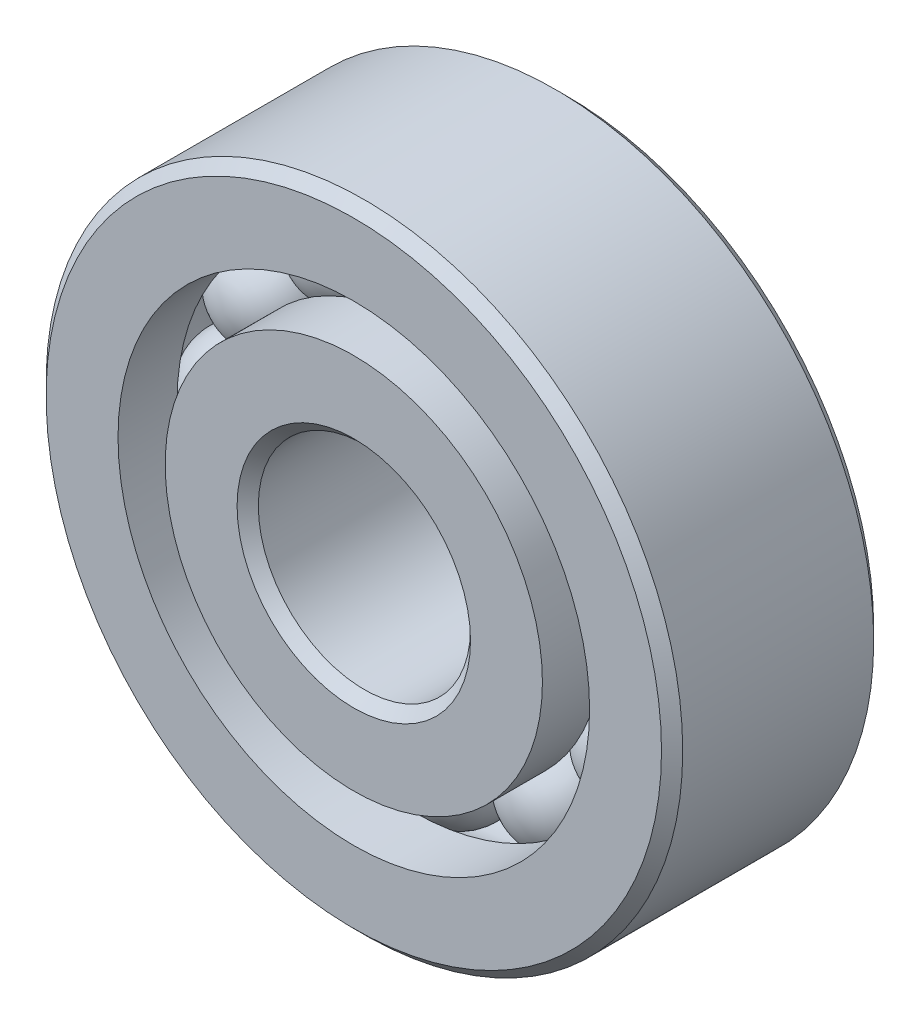
from build123d import *

# Parameters (mm, degrees)
CIRPATTERN1_COUNT = 12


with BuildPart() as part:
    # Sketch1 → Revolve1 (revolve)
    with BuildSketch(Plane(origin=(0, 0, 0), x_dir=(0, 0, -1), z_dir=(1, 0, 0))):
        with BuildLine():
            Line((0.45, 1.5), (-0.45, 1.5))
            Line((-0.45, 1.5), (-0.5, 1.45))
            Line((-0.5, 1.45), (-0.5, 1.111111111))
            Line((-0.5, 1.111111111), (-0.222222222, 1.111111111))
            ThreePointArc((-0.222222222, 1.111111111), (0, 1.248451997), (0.222222222, 1.111111111))
            Line((0.222222222, 1.111111111), (0.5, 1.111111111))
            Line((0.5, 1.111111111), (0.5, 1.45))
            Line((0.5, 1.45), (0.45, 1.5))
        make_face()
    revolve(axis=Axis((0, 0, 0.5), (0, 0, -1)))


with BuildPart() as body_2:
    # Sketch2 → Revolve2 (revolve)
    with BuildSketch(Plane(origin=(0, 0, 0), x_dir=(0, 0, -1), z_dir=(1, 0, 0))):
        with BuildLine():
            Line((-0.5, 0.888888889), (-0.222222222, 0.888888889))
            ThreePointArc((-0.222222222, 0.888888889), (0, 0.751548003), (0.222222222, 0.888888889))
            Line((0.222222222, 0.888888889), (0.5, 0.888888889))
            Line((0.5, 0.888888889), (0.5, 0.55))
            Line((0.5, 0.55), (0.45, 0.5))
            Line((0.45, 0.5), (-0.45, 0.5))
            Line((-0.45, 0.5), (-0.5, 0.55))
            Line((-0.5, 0.55), (-0.5, 0.888888889))
        make_face()
    revolve(axis=Axis((0, 0, 0.5), (0, 0, -1)))


with BuildPart() as body_3:
    # Sketch3 → Revolve3 (revolve)
    with BuildSketch(Plane(origin=(0, 0, 0), x_dir=(0, 0, -1), z_dir=(1, 0, 0))):
        with BuildLine():
            Line((-0.248451997, 1), (0.248451997, 1))
            ThreePointArc((0.248451997, 1), (0, 1.248451997), (-0.248451997, 1))
        make_face()
    revolve(axis=Axis((0, 1, 0.248451997), (0, 0, -1)))


with BuildPart() as cirpattern1_1:
    # CirPattern1: pattern copy
    add(body_3.part.rotate(Axis((0, 0, -0.5), (0, 0, 1)), 1 * 360 / CIRPATTERN1_COUNT))


with BuildPart() as cirpattern1_2:
    # CirPattern1: pattern copy
    add(body_3.part.rotate(Axis((0, 0, -0.5), (0, 0, 1)), 2 * 360 / CIRPATTERN1_COUNT))


with BuildPart() as cirpattern1_3:
    # CirPattern1: pattern copy
    add(body_3.part.rotate(Axis((0, 0, -0.5), (0, 0, 1)), 3 * 360 / CIRPATTERN1_COUNT))


with BuildPart() as cirpattern1_4:
    # CirPattern1: pattern copy
    add(body_3.part.rotate(Axis((0, 0, -0.5), (0, 0, 1)), 4 * 360 / CIRPATTERN1_COUNT))


with BuildPart() as cirpattern1_5:
    # CirPattern1: pattern copy
    add(body_3.part.rotate(Axis((0, 0, -0.5), (0, 0, 1)), 5 * 360 / CIRPATTERN1_COUNT))


with BuildPart() as cirpattern1_6:
    # CirPattern1: pattern copy
    add(body_3.part.rotate(Axis((0, 0, -0.5), (0, 0, 1)), 6 * 360 / CIRPATTERN1_COUNT))


with BuildPart() as cirpattern1_7:
    # CirPattern1: pattern copy
    add(body_3.part.rotate(Axis((0, 0, -0.5), (0, 0, 1)), 7 * 360 / CIRPATTERN1_COUNT))


with BuildPart() as cirpattern1_8:
    # CirPattern1: pattern copy
    add(body_3.part.rotate(Axis((0, 0, -0.5), (0, 0, 1)), 8 * 360 / CIRPATTERN1_COUNT))


with BuildPart() as cirpattern1_9:
    # CirPattern1: pattern copy
    add(body_3.part.rotate(Axis((0, 0, -0.5), (0, 0, 1)), 9 * 360 / CIRPATTERN1_COUNT))


with BuildPart() as cirpattern1_10:
    # CirPattern1: pattern copy
    add(body_3.part.rotate(Axis((0, 0, -0.5), (0, 0, 1)), 10 * 360 / CIRPATTERN1_COUNT))


with BuildPart() as cirpattern1_11:
    # CirPattern1: pattern copy
    add(body_3.part.rotate(Axis((0, 0, -0.5), (0, 0, 1)), 11 * 360 / CIRPATTERN1_COUNT))


solid = Compound([part.part, body_2.part, body_3.part, cirpattern1_1.part, cirpattern1_2.part, cirpattern1_3.part, cirpattern1_4.part, cirpattern1_5.part, cirpattern1_6.part, cirpattern1_7.part, cirpattern1_8.part, cirpattern1_9.part, cirpattern1_10.part, cirpattern1_11.part])
